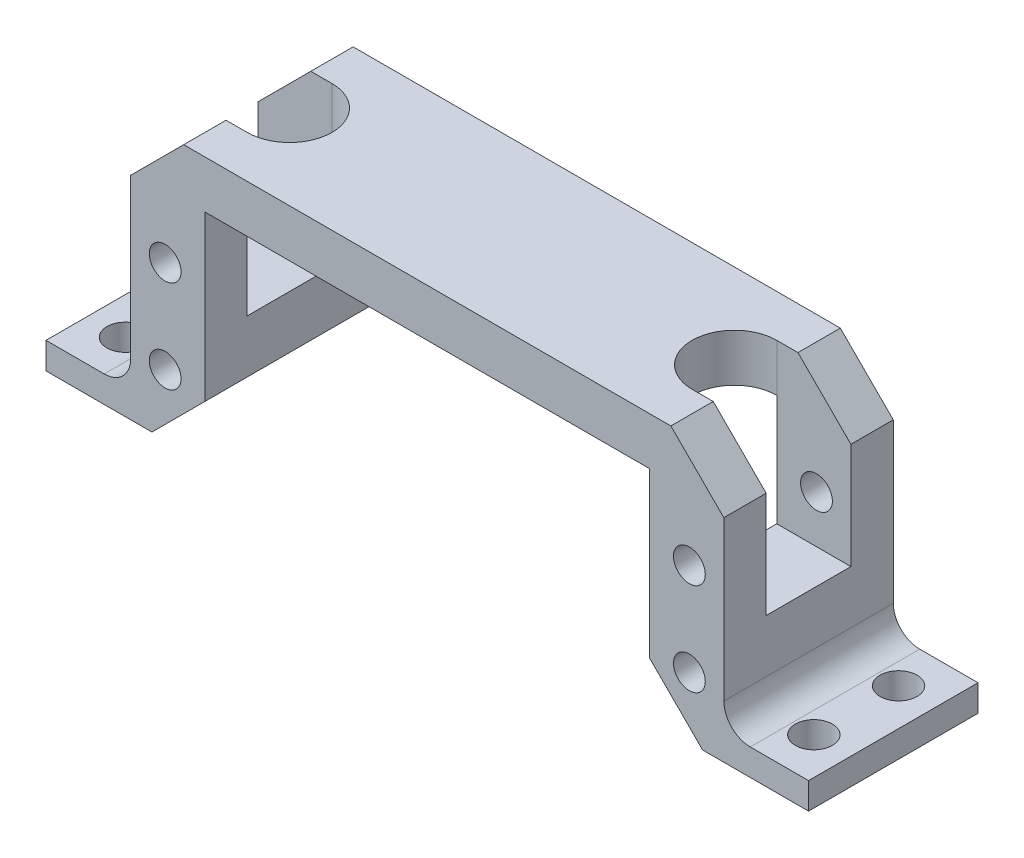
from build123d import *

# Parameters (mm, degrees)
BOSS_EXTRUDE1_DEPTH = 8
CHAMFER5_SIZE       = 5
FILLET1_R           = 2.5
SKETCH2_R           = 1.5
CUT_EXTRUDE1_DEPTH  = 47.658332589
SKETCH3_R           = 1.75
CUT_EXTRUDE2_DEPTH  = 44.200115741
SKETCH5_W           = 7
SKETCH5_H           = 8
CUT_EXTRUDE3_DEPTH  = 15
CUT_EXTRUDE5_DEPTH  = 15


with BuildPart() as part:
    # Sketch1 → Boss-Extrude1 (new, symmetric)
    with BuildSketch(Plane.XY):
        Polygon((-36, 0), (-21, 0), (-21, 20.5), (21, 20.5), (21, 0), (36, 0), (36, 2.5), (28, 2.5), (28, 25), (-28, 25), (-28, 2.5), (-36, 2.5), align=None)
    extrude(amount=BOSS_EXTRUDE1_DEPTH, both=True)

    # Chamfer5
    chamfer5_edges = [part.edges().sort_by_distance(p)[0] for p in [
        (-28, 25, 0),
        (28, 25, 0),
        (21, 0, 0),
        (-21, 0, 0),
    ]]
    chamfer(chamfer5_edges, length=CHAMFER5_SIZE)

    # Fillet1
    fillet1_edges = [part.edges().sort_by_distance(p)[0] for p in [
        (-28, 2.5, 0),
        (28, 2.5, 0),
    ]]
    fillet(fillet1_edges, radius=FILLET1_R)

    # Sketch2 → Cut-Extrude1 (cut, through all)
    with BuildSketch(Plane.XY.offset(8)):
        with Locations((-24.75, 14.475)):
            Circle(SKETCH2_R)
        with Locations((-24.75, 5.725)):
            Circle(SKETCH2_R)
        with Locations((24.75, 14.475)):
            Circle(SKETCH2_R)
        with Locations((24.75, 5.725)):
            Circle(SKETCH2_R)
    extrude(amount=-CUT_EXTRUDE1_DEPTH, mode=Mode.SUBTRACT)

    # Sketch3 → Cut-Extrude2 (cut, through all)
    with BuildSketch(Plane(origin=(0, 2.5, 0), x_dir=(1, 0, 0), z_dir=(0, 1, 0))):
        with Locations(Location((32.5, 4, 0), (0, 0, 270))):
            Circle(SKETCH3_R)
        with Locations(Location((32.5, -4, 0), (0, 0, 270))):
            Circle(SKETCH3_R)
        with Locations(Location((-32.5, 4, 0), (0, 0, 270))):
            Circle(SKETCH3_R)
        with Locations(Location((-32.5, -4, 0), (0, 0, 270))):
            Circle(SKETCH3_R)
    extrude(amount=-CUT_EXTRUDE2_DEPTH, mode=Mode.SUBTRACT)

    # Sketch5 → Cut-Extrude3 (cut)
    with BuildSketch(Plane(origin=(0, 25, 0), x_dir=(1, 0, 0), z_dir=(0, 1, 0))):
        with Locations((24.5, 0)):
            Rectangle(SKETCH5_W, SKETCH5_H)
        with Locations((-24.5, 0)):
            Rectangle(SKETCH5_W, SKETCH5_H)
    extrude(amount=-CUT_EXTRUDE3_DEPTH, mode=Mode.SUBTRACT)

    # Sketch7 → Cut-Extrude5 (cut)
    with BuildSketch(Plane(origin=(0, 25, 0), x_dir=(1, 0, 0), z_dir=(0, 1, 0))):
        with BuildLine():
            Line((21, 4), (21, -4))
            ThreePointArc((21, -4), (17, 0), (21, 4))
        make_face()
        with BuildLine():
            Line((-21, 4), (-21, -4))
            ThreePointArc((-21, -4), (-17, 0), (-21, 4))
        make_face()
    extrude(amount=-CUT_EXTRUDE5_DEPTH, mode=Mode.SUBTRACT)


solid = part.part
